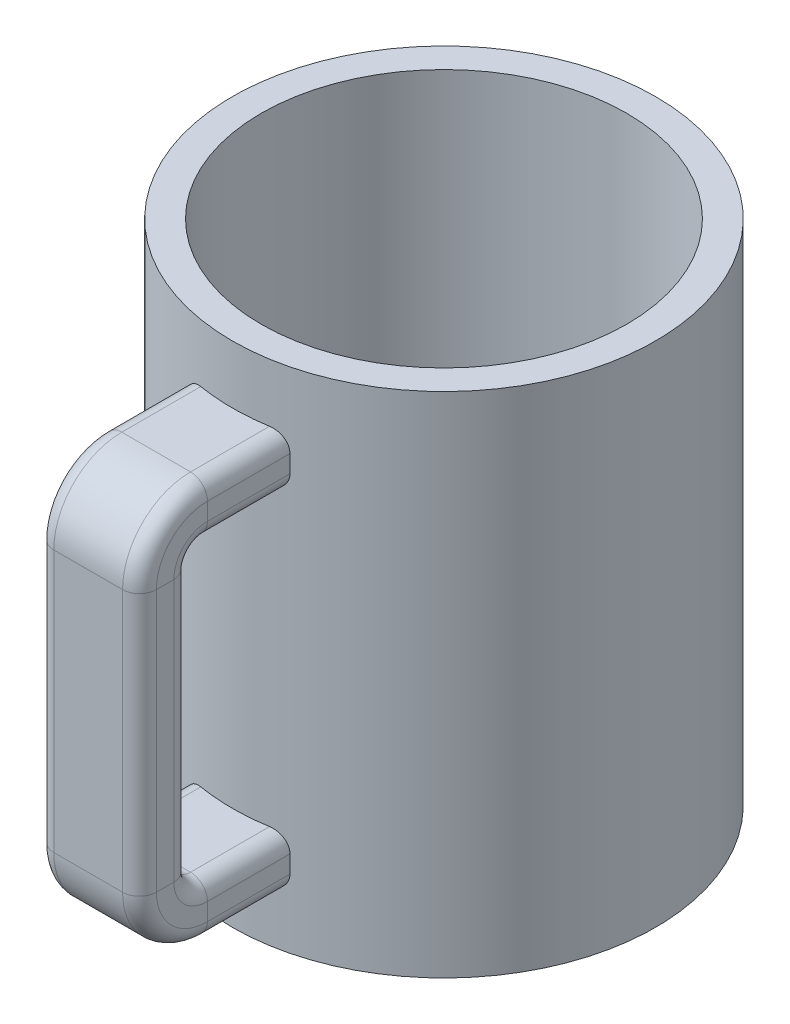
from build123d import *

# Parameters (mm, degrees)
ESBO_O2_W                = 25
ESBO_O2_H                = 60
ESBO_O3_R                = 21.591040813
CORTE_EXTRUS_O1_DEPTH    = 57
RESSALTO_EXTRUS_O1_REACH = 85.869


with BuildPart() as part:
    # Esboço2 → Revolução1 (revolve)
    with BuildSketch(Plane(origin=(0, 0, 0), x_dir=(0, 0, -1), z_dir=(1, 0, 0)), mode=Mode.PRIVATE) as revolu_o1_sk:
        with Locations((-12.5, 30)):
            Rectangle(ESBO_O2_W, ESBO_O2_H)
    revolve(revolu_o1_sk.sketch.rotate(Axis((0, 0, 0), (0, 1, 0)), 180), axis=Axis((0, 0, 0), (0, 1, 0)))

    # Esboço3 → Corte-extrusão1 (cut)
    with BuildSketch(Plane(origin=(0, 60, 0), x_dir=(1, 0, 0), z_dir=(0, 1, 0))):
        with Locations(Location((0, 0, 0), (0, 0, 270))):
            Circle(ESBO_O3_R)
    extrude(amount=-CORTE_EXTRUS_O1_DEPTH, mode=Mode.SUBTRACT)

    # Esboço6 → Ressalto-extrusão1 (add, up to next)
    with BuildSketch(Plane(origin=(0, 0, 28), x_dir=(-1, 0, 0), z_dir=(0, 0, -1)), mode=Mode.PRIVATE) as ressalto_extrus_o1_sk1:
        with BuildLine():
            Line((4.062337727, 53.13495059), (-4.062337727, 53.13495059))
            ThreePointArc((-4.062337727, 53.13495059), (-5.476551289, 52.549164152), (-6.062337727, 51.13495059))
            Line((-6.062337727, 51.13495059), (-6.062337727, 49.072612863))
            ThreePointArc((-6.062337727, 49.072612863), (-5.476551289, 47.658399301), (-4.062337727, 47.072612863))
            Line((-4.062337727, 47.072612863), (4.062337727, 47.072612863))
            ThreePointArc((4.062337727, 47.072612863), (5.476551289, 47.658399301), (6.062337727, 49.072612863))
            Line((6.062337727, 49.072612863), (6.062337727, 51.13495059))
            ThreePointArc((6.062337727, 51.13495059), (5.476551289, 52.549164152), (4.062337727, 53.13495059))
        make_face()
    ressalto_extrus_o1_tool1 = extrude(ressalto_extrus_o1_sk1.sketch, amount=RESSALTO_EXTRUS_O1_REACH, mode=Mode.PRIVATE) - part.part
    # Esboço6 → Ressalto-extrusão1 (add, up to next)
    with BuildSketch(Plane(origin=(0, 0, 28), x_dir=(-1, 0, 0), z_dir=(0, 0, -1)), mode=Mode.PRIVATE) as ressalto_extrus_o1_sk2:
        with BuildLine():
            Line((6.062337727, 8.119097581), (6.062337727, 10.181435308))
            ThreePointArc((6.062337727, 10.181435308), (5.476551289, 11.59564887), (4.062337727, 12.181435308))
            Line((4.062337727, 12.181435308), (-4.062337727, 12.181435308))
            ThreePointArc((-4.062337727, 12.181435308), (-5.476551289, 11.59564887), (-6.062337727, 10.181435308))
            Line((-6.062337727, 10.181435308), (-6.062337727, 8.119097581))
            ThreePointArc((-6.062337727, 8.119097581), (-5.476551289, 6.704884018), (-4.062337727, 6.119097581))
            Line((-4.062337727, 6.119097581), (4.062337727, 6.119097581))
            ThreePointArc((4.062337727, 6.119097581), (5.476551289, 6.704884018), (6.062337727, 8.119097581))
        make_face()
    ressalto_extrus_o1_tool2 = extrude(ressalto_extrus_o1_sk2.sketch, amount=RESSALTO_EXTRUS_O1_REACH, mode=Mode.PRIVATE) - part.part


with BuildPart() as body_2:
    # Varredura1: sweep along a path in Esboço5
    with BuildLine(Plane(origin=(0, 0, 0), x_dir=(0, 0, -1), z_dir=(1, 0, 0))) as varredura1_path:
        Line((-28, 50.103781727), (-34, 50.103781727))
        ThreePointArc((-34, 50.103781727), (-37.535533906, 48.639315633), (-39, 45.103781727))
        Line((-39, 45.103781727), (-39, 14.150266444))
        ThreePointArc((-39, 14.150266444), (-37.535533906, 10.614732538), (-34, 9.150266444))
        Line((-34, 9.150266444), (-28, 9.150266444))
    # Esboço4 → Varredura1 (sweep)
    with BuildSketch(Plane.XY.offset(28)):
        with BuildLine():
            Line((-4.062337727, 53.13495059), (4.062337727, 53.13495059))
            ThreePointArc((4.062337727, 53.13495059), (5.476551289, 52.549164152), (6.062337727, 51.13495059))
            Line((6.062337727, 51.13495059), (6.062337727, 49.072612863))
            ThreePointArc((6.062337727, 49.072612863), (5.476551289, 47.658399301), (4.062337727, 47.072612863))
            Line((4.062337727, 47.072612863), (-4.062337727, 47.072612863))
            ThreePointArc((-4.062337727, 47.072612863), (-5.476551289, 47.658399301), (-6.062337727, 49.072612863))
            Line((-6.062337727, 49.072612863), (-6.062337727, 51.13495059))
            ThreePointArc((-6.062337727, 51.13495059), (-5.476551289, 52.549164152), (-4.062337727, 53.13495059))
        make_face()
    sweep(path=varredura1_path.line)


with BuildPart() as part_1:
    add(part.part)

    add(body_2.part)  # Ressalto-extrusão1 merges body 2
    add(ressalto_extrus_o1_tool1.solids().sort_by_distance((0, 50.103782, 28))[0])
    add(ressalto_extrus_o1_tool2.solids().sort_by_distance((0, 9.150266, 28))[0])


solid = part_1.part
